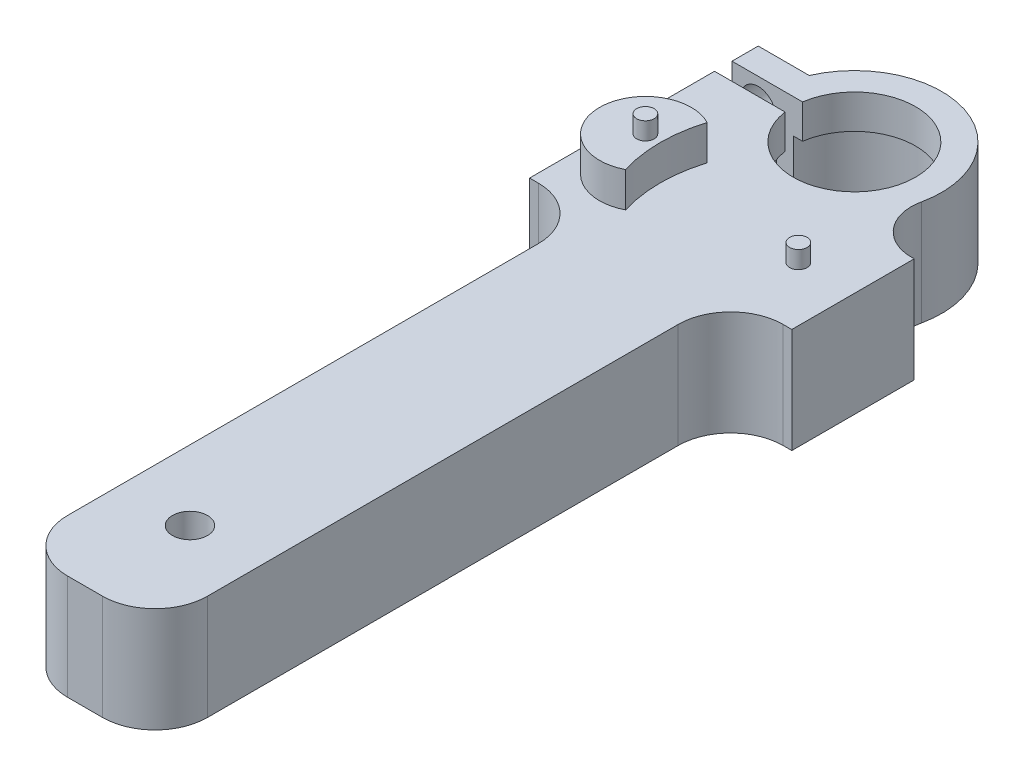
from build123d import *

# Parameters (mm, degrees)
BASEARM_W             = 8
BASEARM_H             = 40
BOSS_EXTRUDE1_DEPTH   = 3
SKETCH2_R             = 5
SKETCH2_R_2           = 4
BOSS_EXTRUDE2_DEPTH   = 3
BOSS_EXTRUDE3_REACH   = 42.423
SKETCH3_W             = 1
SKETCH3_H             = 3
F_2_0MM_DOWEL_HOLE3_D = 2
SKETCH13_W            = 15
SKETCH13_H            = 7
SKETCH13_R            = 0.5
BOSS_EXTRUDE7_DEPTH   = 3
SKETCH15_W            = 3.5
SKETCH15_H            = 6.077722283
BOSS_EXTRUDE8_DEPTH   = 3
BOSS_EXTRUDE9_START   = -1.95
SKETCH20_R            = 4
SKETCH20_R_2          = 3.5
BOSS_EXTRUDE9_DEPTH   = 1.95
SKETCH16_W            = 4.035898385
SKETCH16_H            = 1
CUT_EXTRUDE5_DEPTH    = 3
BOSS_EXTRUDE10_START  = -4
SKETCH21_R            = 0.5
BOSS_EXTRUDE10_DEPTH  = 4
BOSS_EXTRUDE11_START  = 2
SKETCH22_R            = 0.5
BOSS_EXTRUDE11_DEPTH  = 2
BOSS_EXTRUDE12_DEPTH  = 2
M2_TAPPED_HOLE1_D     = 1.6
M2_TAPPED_HOLE1_DEPTH = 10
M2_TAPPED_HOLE1_TIP   = 0.480688495
CUT_EXTRUDE6_REACH    = 48.992
SKETCH28_R            = 1
BOSS_EXTRUDE13_START  = 3
SKETCH29_R            = 1
BOSS_EXTRUDE13_DEPTH  = 3
BOSS_EXTRUDE14_START  = 0.01
SKETCH30_R            = 1
BOSS_EXTRUDE14_DEPTH  = 0.01
FILLET3_R             = 3
BOSS_EXTRUDE15_START  = -6
BOSS_EXTRUDE15_DEPTH  = 6


with BuildPart() as part:
    # BaseArm → Boss-Extrude1 (new body)
    with BuildSketch(Plane(origin=(0, 0, 0), x_dir=(1, 0, 0), z_dir=(0, 1, 0))):
        with Locations((0, 20)):
            Rectangle(BASEARM_W, BASEARM_H)
    extrude(amount=BOSS_EXTRUDE1_DEPTH)

    # Sketch2 → Boss-Extrude2 (add)
    with BuildSketch(Plane(origin=(0, 0, 0), x_dir=(1, 0, 0), z_dir=(0, 1, 0))):
        with Locations((0, 44)):
            Circle(SKETCH2_R)
        with Locations(Location((0, 44, 0), (0, 0, 270))):
            Circle(SKETCH2_R_2, mode=Mode.SUBTRACT)
    extrude(amount=BOSS_EXTRUDE2_DEPTH)

    # Sketch3 → Boss-Extrude3 (add, up to next)
    with BuildSketch(Plane(origin=(0, 0, -40), x_dir=(-1, 0, 0), z_dir=(0, 0, -1)), mode=Mode.PRIVATE) as boss_extrude3_sk1:
        with Locations((-3.5, 1.5)):
            Rectangle(SKETCH3_W, SKETCH3_H)
    boss_extrude3_tool1 = extrude(boss_extrude3_sk1.sketch, amount=BOSS_EXTRUDE3_REACH, mode=Mode.PRIVATE) - part.part
    # Sketch3 → Boss-Extrude3 (add, up to next)
    with BuildSketch(Plane(origin=(0, 0, -40), x_dir=(-1, 0, 0), z_dir=(0, 0, -1)), mode=Mode.PRIVATE) as boss_extrude3_sk2:
        with Locations((3.5, 1.5)):
            Rectangle(SKETCH3_W, SKETCH3_H)
    boss_extrude3_tool2 = extrude(boss_extrude3_sk2.sketch, amount=BOSS_EXTRUDE3_REACH, mode=Mode.PRIVATE) - part.part
    add(boss_extrude3_tool1.solids().sort_by_distance((3.5, 1.5, -40))[0])
    add(boss_extrude3_tool2.solids().sort_by_distance((-3.5, 1.5, -40))[0])

    # Ø2.0mm Dowel Hole3 (through all)
    with Locations(Plane(origin=(0, 3, -6), x_dir=(0, 0, 1), z_dir=(0, 1, 0))):
        with Locations((0, 0)):
            Hole(F_2_0MM_DOWEL_HOLE3_D / 2)

    # Sketch13 → Boss-Extrude7 (add)
    with BuildSketch(Plane(origin=(0, 3, 0), x_dir=(1, 0, 0), z_dir=(0, 1, 0))):
        with Locations((0, 36.422277717)):
            Rectangle(SKETCH13_W, SKETCH13_H)
        with Locations((-4.375, 36.422277717)):
            Circle(SKETCH13_R, mode=Mode.SUBTRACT)
        with Locations((4.375, 36.422277717)):
            Circle(SKETCH13_R, mode=Mode.SUBTRACT)
    extrude(amount=-BOSS_EXTRUDE7_DEPTH)

    # Sketch15 → Boss-Extrude8 (add)
    with BuildSketch(Plane(origin=(0, 3, 0), x_dir=(1, 0, 0), z_dir=(0, 1, 0))):
        with Locations((-5.75, 42.961138859)):
            Rectangle(SKETCH15_W, SKETCH15_H)
    extrude(amount=-BOSS_EXTRUDE8_DEPTH)

    # Sketch20 → Boss-Extrude9 (add)
    with BuildSketch(Plane(origin=(0, 3, 0), x_dir=(1, 0, 0), z_dir=(0, 1, 0)).offset(BOSS_EXTRUDE9_START)):
        with Locations(Location((0, 44, 0), (0, 0, 270))):
            Circle(SKETCH20_R)
        with Locations(Location((0, 44, 0), (0, 0, 270))):
            Circle(SKETCH20_R_2, mode=Mode.SUBTRACT)
    extrude(amount=BOSS_EXTRUDE9_DEPTH)

    # Sketch16 → Cut-Extrude5 (cut)
    with BuildSketch(Plane(origin=(0, 3, 0), x_dir=(1, 0, 0), z_dir=(0, 1, 0))):
        with Locations((-5.482050808, 44)):
            Rectangle(SKETCH16_W, SKETCH16_H)
    extrude(amount=-CUT_EXTRUDE5_DEPTH, mode=Mode.SUBTRACT)

    # Sketch21 → Boss-Extrude10 (add)
    with BuildSketch(Plane.XZ.offset(BOSS_EXTRUDE10_START)):
        with Locations(Location((-4.375, -36.422277717, 0), (0, 0, 270))):
            Circle(SKETCH21_R)
        with Locations(Location((4.375, -36.422277717, 0), (0, 0, 270))):
            Circle(SKETCH21_R)
    extrude(amount=BOSS_EXTRUDE10_DEPTH)

    # Sketch22 → Boss-Extrude11 (add)
    with BuildSketch(Plane(origin=(0, 4, 0), x_dir=(1, 0, 0), z_dir=(0, 1, 0)).offset(BOSS_EXTRUDE11_START)):
        with Locations(Location((-4.375, 36.422277717, 0), (0, 0, 270))):
            Circle(SKETCH22_R)
    extrude(amount=-BOSS_EXTRUDE11_DEPTH)

    # Sketch23 → Boss-Extrude12 (add)
    with BuildSketch(Plane(origin=(0, 3, 0), x_dir=(1, 0, 0), z_dir=(0, 1, 0))):
        with BuildLine():
            ThreePointArc((-3.172535714, 38.755666806), (-7, 36.422277717), (-3.172535714, 34.088888628))
            ThreePointArc((-3.172535714, 34.088888628), (-3.525, 36.422277717), (-3.172535714, 38.755666806))
        make_face()
    extrude(amount=BOSS_EXTRUDE12_DEPTH)

    # M2 Tapped Hole1
    with Locations(Plane(origin=(0, 0, -46), x_dir=(-1, 0, 0), z_dir=(0, 0, -1))):
        with Locations((6, 1.5)):
            Hole(M2_TAPPED_HOLE1_D / 2, depth=M2_TAPPED_HOLE1_DEPTH)
            with Locations((0, 0, -(M2_TAPPED_HOLE1_DEPTH + M2_TAPPED_HOLE1_TIP / 2))):  # 118° drill point
                Cone(0, M2_TAPPED_HOLE1_D / 2, M2_TAPPED_HOLE1_TIP, mode=Mode.SUBTRACT)

    # Sketch28 → Cut-Extrude6 (cut, up to next)
    with BuildSketch(Plane(origin=(0, 0, -46), x_dir=(-1, 0, 0), z_dir=(0, 0, -1)), mode=Mode.PRIVATE) as cut_extrude6_sk1:
        with Locations((6, 1.5)):
            Circle(SKETCH28_R)
    cut_extrude6_tool1 = extrude(cut_extrude6_sk1.sketch, amount=-CUT_EXTRUDE6_REACH, mode=Mode.PRIVATE) & part.part
    add(cut_extrude6_tool1.solids().sort_by_distance((-6, 1.5, -46))[0], mode=Mode.SUBTRACT)

    # Sketch29 → Boss-Extrude13 (add)
    with BuildSketch(Plane.XZ.offset(BOSS_EXTRUDE13_START)):
        with BuildLine():
            Line((4, -41), (4, -39.922277717))
            Line((4, -39.922277717), (7.5, -39.922277717))
            Line((7.5, -39.922277717), (7.5, -32.922277717))
            Line((7.5, -32.922277717), (4, -32.922277717))
            Line((4, -32.922277717), (4, 0))
            Line((4, 0), (-4, 0))
            Line((-4, 0), (-4, -32.922277717))
            Line((-4, -32.922277717), (-7.5, -32.922277717))
            Line((-7.5, -32.922277717), (-7.5, -43.5))
            Line((-7.5, -43.5), (-3.968626967, -43.5))
            ThreePointArc((-3.968626967, -43.5), (4, -44), (-3.968626967, -44.5))
            Line((-3.968626967, -44.5), (-7.5, -44.5))
            Line((-7.5, -44.5), (-7.5, -46))
            Line((-7.5, -46), (-4.582575695, -46))
            ThreePointArc((-4.582575695, -46), (2.516912515, -48.320318436), (4, -41))
        make_face()
        with Locations(Location((0, -6, 0), (0, 0, 90))):
            Circle(SKETCH29_R, mode=Mode.SUBTRACT)
    extrude(amount=-BOSS_EXTRUDE13_DEPTH)

    # Sketch30 → Boss-Extrude14 (add)
    with BuildSketch(Plane.XZ.offset(3).offset(BOSS_EXTRUDE14_START)):
        with BuildLine():
            Line((4, -16.781929326), (4, 0))
            Line((4, 0), (-4, 0))
            Line((-4, 0), (-4, -16.781929326))
            ThreePointArc((-4, -16.781929326), (0, -17.5), (4, -16.781929326))
        make_face()
        with Locations(Location((0, -6, 0), (0, 0, 90))):
            Circle(SKETCH30_R, mode=Mode.SUBTRACT)
    extrude(amount=-BOSS_EXTRUDE14_DEPTH)

    # Fillet3
    fillet3_edges = [part.edges().sort_by_distance(p)[0] for p in [
        (-4, 0, -32.922277717),
        (4, 0, -32.922277717),
        (4, -0.005, 0),
        (-4, -0.005, 0),
    ]]
    fillet(fillet3_edges, radius=FILLET3_R)

    # Sketch31 → Boss-Extrude15 (add)
    with BuildSketch(Plane(origin=(0, 3, 0), x_dir=(1, 0, 0), z_dir=(0, 1, 0)).offset(BOSS_EXTRUDE15_START)):
        with BuildLine():
            Line((7.332175148, 39.922277717), (4, 39.922277717))
            Line((4, 39.922277717), (4, 41))
            ThreePointArc((4, 41), (4.549561654, 41.925996926), (4.888116765, 42.948185145))
            ThreePointArc((4.888116765, 42.948185145), (5.387339863, 40.851413077), (7.332175148, 39.922277717))
        make_face()
    extrude(amount=BOSS_EXTRUDE15_DEPTH)


solid = part.part
